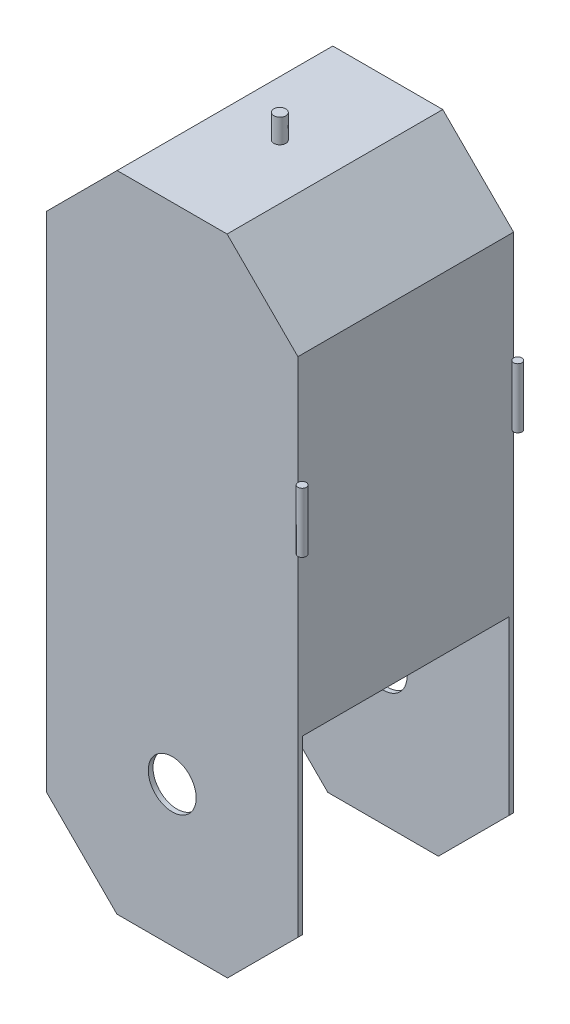
from build123d import *

# Parameters (mm, degrees)
EXTRUDE_1_DEPTH       = 180
SKETCH1_W             = 172
SKETCH1_H             = 208.862338185
CUT_EXTRUDE1_DEPTH    = 698.966972306
SKETCH2_R             = 20
CUT_EXTRUDE2_DEPTH    = 674.869657154
SKETCH3_R             = 3.5
BOSS_EXTRUDE1_DEPTH   = 50
BOSS_EXTRUDE1_2_DEPTH = 50
SKETCH4_R             = 5
BOSS_EXTRUDE2_DEPTH   = 20


with BuildPart() as part:
    # Эскиз1 → Вытянуть1 (new body)
    with BuildSketch(Plane.XY):
        Polygon((105.082921559, 581.722068254), (45.979042749, 640.825947064), (-45.813199631, 640.825947064), (-104.917078441, 581.722068254), (-104.917078441, 162.212880509), (-45.97317451, 103.268976578), (46.326817337, 103.268976578), (105.082921559, 162.0250808), align=None)
    extrude(amount=EXTRUDE_1_DEPTH)

    # Sketch1 → Cut-Extrude1 (cut, through all)
    with BuildSketch(Plane(origin=(105.082921559, 0, 0), x_dir=(0, 0, -1), z_dir=(1, 0, 0))):
        with Locations((-90, 201.194997681)):
            Rectangle(SKETCH1_W, SKETCH1_H)
    extrude(amount=-CUT_EXTRUDE1_DEPTH, mode=Mode.SUBTRACT)

    # Sketch2 → Cut-Extrude2 (cut, through all)
    with BuildSketch(Plane(origin=(0, 0, 0), x_dir=(-1, 0, 0), z_dir=(0, 0, -1))):
        with Locations((-0.176821413, 220.268976578)):
            Circle(SKETCH2_R)
    extrude(amount=-CUT_EXTRUDE2_DEPTH, mode=Mode.SUBTRACT)

    # Sketch4 → Boss-Extrude2 (add)
    with BuildSketch(Plane(origin=(0, 640.825947064, 0), x_dir=(1, 0, 0), z_dir=(0, 1, 0))):
        with Locations((0, -90)):
            Circle(SKETCH4_R)
    extrude(amount=BOSS_EXTRUDE2_DEPTH)


with BuildPart() as body_2:
    # Sketch3 → Boss-Extrude1 (new body)
    with BuildSketch(Plane(origin=(0, 440.825947064, 0), x_dir=(1, 0, 0), z_dir=(0, 1, 0))):
        with Locations(Location((108.582921559, 0, 0), (0, 0, 180))):
            Circle(SKETCH3_R)
    extrude(amount=BOSS_EXTRUDE1_DEPTH)


with BuildPart() as body_3:
    # Sketch3 → Boss-Extrude1 2 (new body)
    with BuildSketch(Plane(origin=(0, 440.825947064, 0), x_dir=(1, 0, 0), z_dir=(0, 1, 0))):
        with Locations((108.582921559, -180)):
            Circle(SKETCH3_R)
    extrude(amount=BOSS_EXTRUDE1_2_DEPTH)


solid = Compound([part.part, body_2.part, body_3.part])
